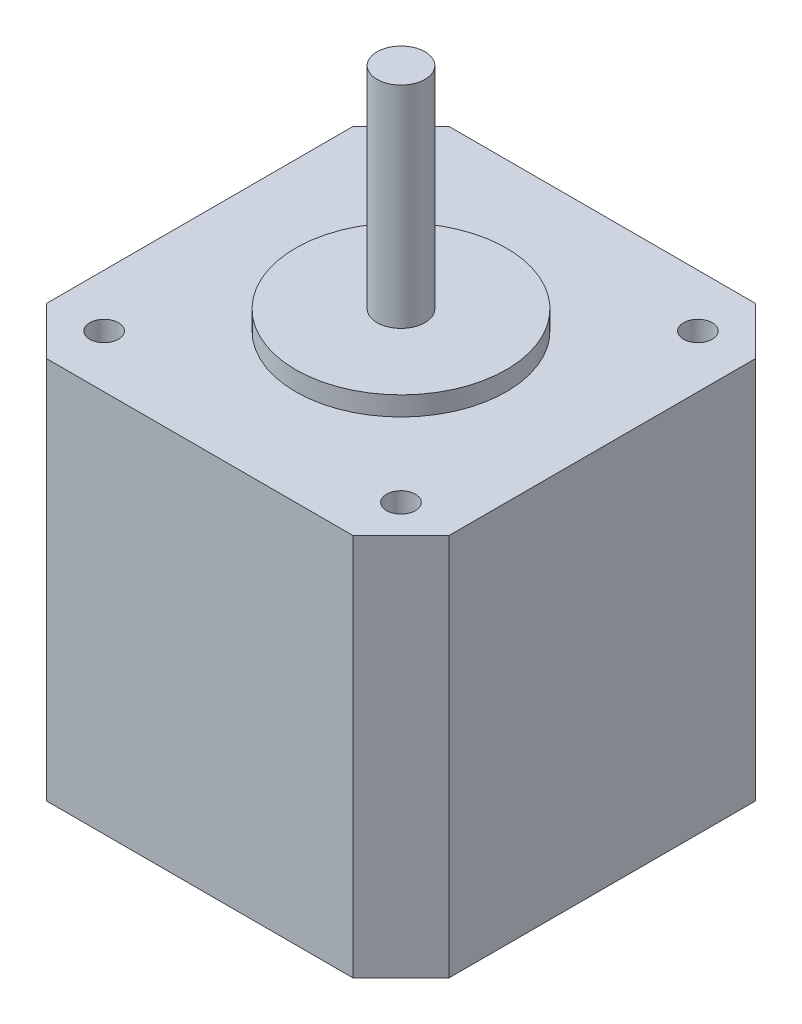
from build123d import *

# Parameters (mm, degrees)
SKETCH_1_W          = 42
SKETCH_1_H          = 42
EXTRUDE_1_DEPTH     = 40
SKETCH_2_R          = 11
EXTRUDE_2_DEPTH     = 2
SKETCH_3_R          = 2.5
EXTRUDE_3_DEPTH     = 22
SKETCH_4_R          = 1.5
CUT_EXTRUDE_1_DEPTH = 4.5
CHAMFER_1_SIZE      = 5
SKETCH_5_W          = 16.42199876
SKETCH_5_H          = 2.116075979
EXTRUDE_4_DEPTH     = 7


with BuildPart() as part:
    # 草图1 → 凸台-拉伸1 (new body)
    with BuildSketch(Plane(origin=(0, 0, 0), x_dir=(1, 0, 0), z_dir=(0, 1, 0))):
        Rectangle(SKETCH_1_W, SKETCH_1_H)
    extrude(amount=EXTRUDE_1_DEPTH)

    # 草图2 → 凸台-拉伸2 (add)
    with BuildSketch(Plane(origin=(0, 40, 0), x_dir=(1, 0, 0), z_dir=(0, 1, 0))):
        with Locations(Location((0, 0, 0), (0, 0, 270))):
            Circle(SKETCH_2_R)
    extrude(amount=EXTRUDE_2_DEPTH)

    # 草图3 → 凸台-拉伸3 (add)
    with BuildSketch(Plane(origin=(0, 42, 0), x_dir=(1, 0, 0), z_dir=(0, 1, 0))):
        with Locations(Location((0, 0, 0), (0, 0, 270))):
            Circle(SKETCH_3_R)
    extrude(amount=EXTRUDE_3_DEPTH)

    # 草图4 → 切除-拉伸1 (cut)
    with BuildSketch(Plane(origin=(0, 40, 0), x_dir=(1, 0, 0), z_dir=(0, 1, 0))):
        with Locations(Location((-15.5, 15.5, 0), (0, 0, 270))):
            Circle(SKETCH_4_R)
        with Locations(Location((15.5, 15.5, 0), (0, 0, 270))):
            Circle(SKETCH_4_R)
        with Locations(Location((15.5, -15.5, 0), (0, 0, 270))):
            Circle(SKETCH_4_R)
        with Locations(Location((-15.5, -15.5, 0), (0, 0, 270))):
            Circle(SKETCH_4_R)
    extrude(amount=-CUT_EXTRUDE_1_DEPTH, mode=Mode.SUBTRACT)

    # 倒角1
    chamfer_1_edges = [part.edges().sort_by_distance(p)[0] for p in [
        (21, 20, 21),
        (-21, 20, 21),
        (-21, 20, -21),
        (21, 20, -21),
    ]]
    chamfer(chamfer_1_edges, length=CHAMFER_1_SIZE)

    # 草图5 → 凸台-拉伸4 (add)
    with BuildSketch(Plane.ZY.offset(21)):
        with Locations((0, 1.05803799)):
            Rectangle(SKETCH_5_W, SKETCH_5_H)
    extrude(amount=EXTRUDE_4_DEPTH)


solid = part.part
